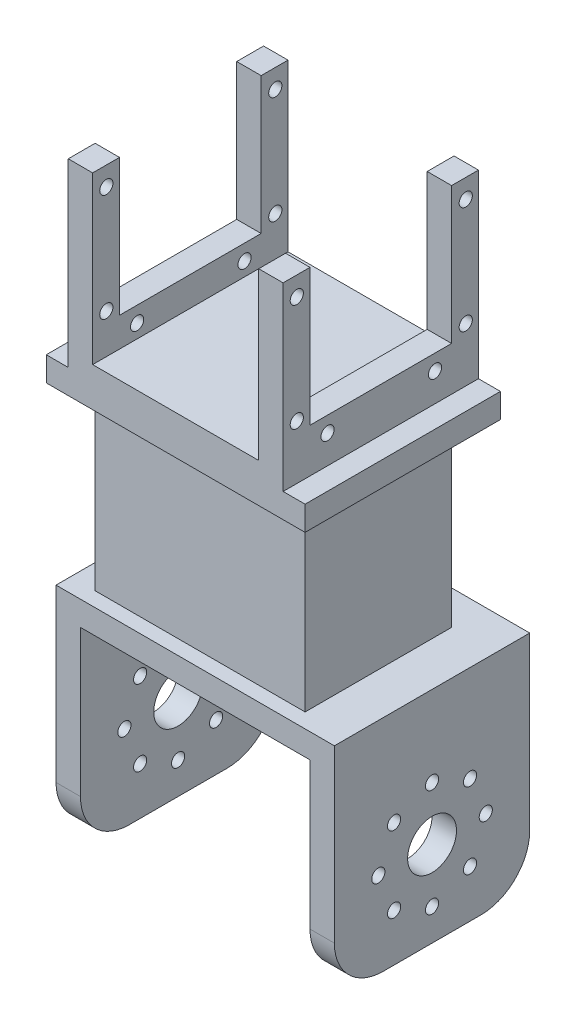
from build123d import *

# Parameters (mm, degrees)
SKETCH2_W               = 34
SKETCH2_H               = 40
BOSS_EXTRUDE1_DEPTH     = 3
SKETCH3_W               = 5
SKETCH3_H               = 40
BOSS_EXTRUDE2_DEPTH     = 37
CUT_EXTRUDE1_REACH      = 72.036
SKETCH4_R               = 1.35
SKETCH4_W               = 29
SKETCH4_H               = 28
SKETCH5_W               = 53
SKETCH5_H               = 40
BOSS_EXTRUDE3_DEPTH     = 5
SKETCH6_W               = 43
SKETCH6_H               = 30
BOSS_EXTRUDE4_DEPTH     = 36.85
SKETCH7_W               = 53
SKETCH7_H               = 40
BOSS_EXTRUDE5_DEPTH     = 5
SKETCH8_W               = 5
SKETCH8_H               = 40
BOSS_EXTRUDE6_DEPTH     = 40
SKETCH8_3_W             = 2
SKETCH8_3_H             = 40
BOSS_EXTRUDE7_DEPTH     = 5
CUT_EXTRUDE2_DEPTH      = 108.532192854
CUT_EXTRUDE2_DEPTH_BACK = 108.532192854
SKETCH9_R               = 1.35
SKETCH9_R_2             = 5


with BuildPart() as part:
    # Sketch2 → Boss-Extrude1 (new body)
    with BuildSketch(Plane(origin=(0, 0, 0), x_dir=(1, 0, 0), z_dir=(0, 1, 0))):
        with Locations((17, 20)):
            Rectangle(SKETCH2_W, SKETCH2_H)
    extrude(amount=BOSS_EXTRUDE1_DEPTH)

    # Sketch3 → Boss-Extrude2 (add)
    with BuildSketch(Plane(origin=(0, 0, 0), x_dir=(1, 0, 0), z_dir=(0, 1, 0))):
        with Locations((-2.5, 20)):
            Rectangle(SKETCH3_W, SKETCH3_H)
        with Locations((36.5, 20)):
            Rectangle(SKETCH3_W, SKETCH3_H)
    extrude(amount=BOSS_EXTRUDE2_DEPTH)

    # Cut-Extrude1: up to this face of the body (flat: up to its plane)
    cut_extrude1_end = Plane(part.part.faces().sort_by_distance((39, 18.5, -20))[0])
    # Sketch4 → Cut-Extrude1 (cut, up to the picked face)
    with BuildSketch(Plane.ZY.offset(5), mode=Mode.PRIVATE) as cut_extrude1_sk1:
        with Locations((-2.8, 33.1)):
            Circle(SKETCH4_R)
    cut_extrude1_tool1 = split(extrude(cut_extrude1_sk1.sketch, amount=-CUT_EXTRUDE1_REACH, mode=Mode.PRIVATE), bisect_by=cut_extrude1_end, keep=Keep.BOTH, mode=Mode.PRIVATE)
    # Sketch4 → Cut-Extrude1 (cut, up to the picked face)
    with BuildSketch(Plane.ZY.offset(5), mode=Mode.PRIVATE) as cut_extrude1_sk2:
        with Locations((-2.8, 11.1)):
            Circle(SKETCH4_R)
    cut_extrude1_tool2 = split(extrude(cut_extrude1_sk2.sketch, amount=-CUT_EXTRUDE1_REACH, mode=Mode.PRIVATE), bisect_by=cut_extrude1_end, keep=Keep.BOTH, mode=Mode.PRIVATE)
    # Sketch4 → Cut-Extrude1 (cut, up to the picked face)
    with BuildSketch(Plane.ZY.offset(5), mode=Mode.PRIVATE) as cut_extrude1_sk3:
        with Locations((-9.1, 5.8)):
            Circle(SKETCH4_R)
    cut_extrude1_tool3 = split(extrude(cut_extrude1_sk3.sketch, amount=-CUT_EXTRUDE1_REACH, mode=Mode.PRIVATE), bisect_by=cut_extrude1_end, keep=Keep.BOTH, mode=Mode.PRIVATE)
    # Sketch4 → Cut-Extrude1 (cut, up to the picked face)
    with BuildSketch(Plane.ZY.offset(5), mode=Mode.PRIVATE) as cut_extrude1_sk4:
        with Locations((-37.4, 11.1)):
            Circle(SKETCH4_R)
    cut_extrude1_tool4 = split(extrude(cut_extrude1_sk4.sketch, amount=-CUT_EXTRUDE1_REACH, mode=Mode.PRIVATE), bisect_by=cut_extrude1_end, keep=Keep.BOTH, mode=Mode.PRIVATE)
    # Sketch4 → Cut-Extrude1 (cut, up to the picked face)
    with BuildSketch(Plane.ZY.offset(5), mode=Mode.PRIVATE) as cut_extrude1_sk5:
        with Locations((-31.1, 5.8)):
            Circle(SKETCH4_R)
    cut_extrude1_tool5 = split(extrude(cut_extrude1_sk5.sketch, amount=-CUT_EXTRUDE1_REACH, mode=Mode.PRIVATE), bisect_by=cut_extrude1_end, keep=Keep.BOTH, mode=Mode.PRIVATE)
    # Sketch4 → Cut-Extrude1 (cut, up to the picked face)
    with BuildSketch(Plane.ZY.offset(5), mode=Mode.PRIVATE) as cut_extrude1_sk6:
        with Locations((-37.4, 33.1)):
            Circle(SKETCH4_R)
    cut_extrude1_tool6 = split(extrude(cut_extrude1_sk6.sketch, amount=-CUT_EXTRUDE1_REACH, mode=Mode.PRIVATE), bisect_by=cut_extrude1_end, keep=Keep.BOTH, mode=Mode.PRIVATE)
    # Sketch4 → Cut-Extrude1 (cut, up to the picked face)
    with BuildSketch(Plane.ZY.offset(5), mode=Mode.PRIVATE) as cut_extrude1_sk7:
        with Locations((-20, 23)):
            Rectangle(SKETCH4_W, SKETCH4_H)
    cut_extrude1_tool7 = split(extrude(cut_extrude1_sk7.sketch, amount=-CUT_EXTRUDE1_REACH, mode=Mode.PRIVATE), bisect_by=cut_extrude1_end, keep=Keep.BOTH, mode=Mode.PRIVATE)
    add(cut_extrude1_tool1.solids().sort_by(Axis((-5, 33.1, -2.8), (1, 0, 0)))[0], mode=Mode.SUBTRACT)
    add(cut_extrude1_tool2.solids().sort_by(Axis((-5, 11.1, -2.8), (1, 0, 0)))[0], mode=Mode.SUBTRACT)
    add(cut_extrude1_tool3.solids().sort_by(Axis((-5, 5.8, -9.1), (1, 0, 0)))[0], mode=Mode.SUBTRACT)
    add(cut_extrude1_tool4.solids().sort_by(Axis((-5, 11.1, -37.4), (1, 0, 0)))[0], mode=Mode.SUBTRACT)
    add(cut_extrude1_tool5.solids().sort_by(Axis((-5, 5.8, -31.1), (1, 0, 0)))[0], mode=Mode.SUBTRACT)
    add(cut_extrude1_tool6.solids().sort_by(Axis((-5, 33.1, -37.4), (1, 0, 0)))[0], mode=Mode.SUBTRACT)
    add(cut_extrude1_tool7.solids().sort_by(Axis((-5, 23, -20), (1, 0, 0)))[0], mode=Mode.SUBTRACT)

    # Sketch5 → Boss-Extrude3 (add)
    with BuildSketch(Plane(origin=(0, 0, 0), x_dir=(-1, 0, 0), z_dir=(0, -1, 0))):
        with Locations((-17, 20)):
            Rectangle(SKETCH5_W, SKETCH5_H)
    extrude(amount=BOSS_EXTRUDE3_DEPTH)

    # Sketch6 → Boss-Extrude4 (add)
    with BuildSketch(Plane.XZ.offset(5)):
        with Locations((17, -20)):
            Rectangle(SKETCH6_W, SKETCH6_H)
    extrude(amount=BOSS_EXTRUDE4_DEPTH)

    # Sketch7 → Boss-Extrude5 (add)
    with BuildSketch(Plane.XZ.offset(41.85)):
        with Locations((19, -22)):
            Rectangle(SKETCH7_W, SKETCH7_H)
    extrude(amount=BOSS_EXTRUDE5_DEPTH)

    # Sketch8 → Boss-Extrude6 (add)
    with BuildSketch(Plane.XZ.offset(46.85)):
        with Locations((-7, -22)):
            Rectangle(SKETCH8_W, SKETCH8_H)
        with Locations((45, -22)):
            Rectangle(SKETCH8_W, SKETCH8_H)
    extrude(amount=BOSS_EXTRUDE6_DEPTH)

    # Sketch8<3> → Boss-Extrude7 (add)
    with BuildSketch(Plane.XZ.offset(46.85)):
        with Locations((46.5, -22)):
            Rectangle(SKETCH8_3_W, SKETCH8_3_H)
        with Locations((-8.5, -22)):
            Rectangle(SKETCH8_3_W, SKETCH8_3_H)
    extrude(amount=-BOSS_EXTRUDE7_DEPTH)

    # Sketch9 → Cut-Extrude2 (cut, two sides: drawn at the far end of the back side and taken through both)
    with BuildSketch(Plane.ZY.offset(-CUT_EXTRUDE2_DEPTH_BACK)):
        with BuildLine():
            Line((-2, -86.85), (-12, -86.85))
            ThreePointArc((-12, -86.85), (-4.928932188, -83.921067812), (-2, -76.85))
            Line((-2, -76.85), (-2, -86.85))
        make_face()
        with BuildLine():
            ThreePointArc((-32, -86.85), (-39.071067812, -83.921067812), (-42, -76.85))
            Line((-42, -76.85), (-42, -86.85))
            Line((-42, -86.85), (-32, -86.85))
        make_face()
        with Locations(Location((-14.221825407, -77.128174593, 0), (0, 0, 180))):
            Circle(SKETCH9_R)
        with Locations(Location((-22, -80.35, 0), (0, 0, 180))):
            Circle(SKETCH9_R)
        with Locations(Location((-29.778174593, -77.128174593, 0), (0, 0, 180))):
            Circle(SKETCH9_R)
        with Locations(Location((-29.778174593, -61.571825407, 0), (0, 0, 180))):
            Circle(SKETCH9_R)
        with Locations(Location((-33, -69.35, 0), (0, 0, 180))):
            Circle(SKETCH9_R)
        with Locations(Location((-22, -69.35, 0), (0, 0, 180))):
            Circle(SKETCH9_R_2)
        with Locations(Location((-11, -69.35, 0), (0, 0, 180))):
            Circle(SKETCH9_R)
        with Locations(Location((-14.221825407, -61.571825407, 0), (0, 0, 180))):
            Circle(SKETCH9_R)
        with Locations(Location((-22, -58.35, 0), (0, 0, 180))):
            Circle(SKETCH9_R)
    extrude(amount=CUT_EXTRUDE2_DEPTH + CUT_EXTRUDE2_DEPTH_BACK, mode=Mode.SUBTRACT)


solid = part.part
